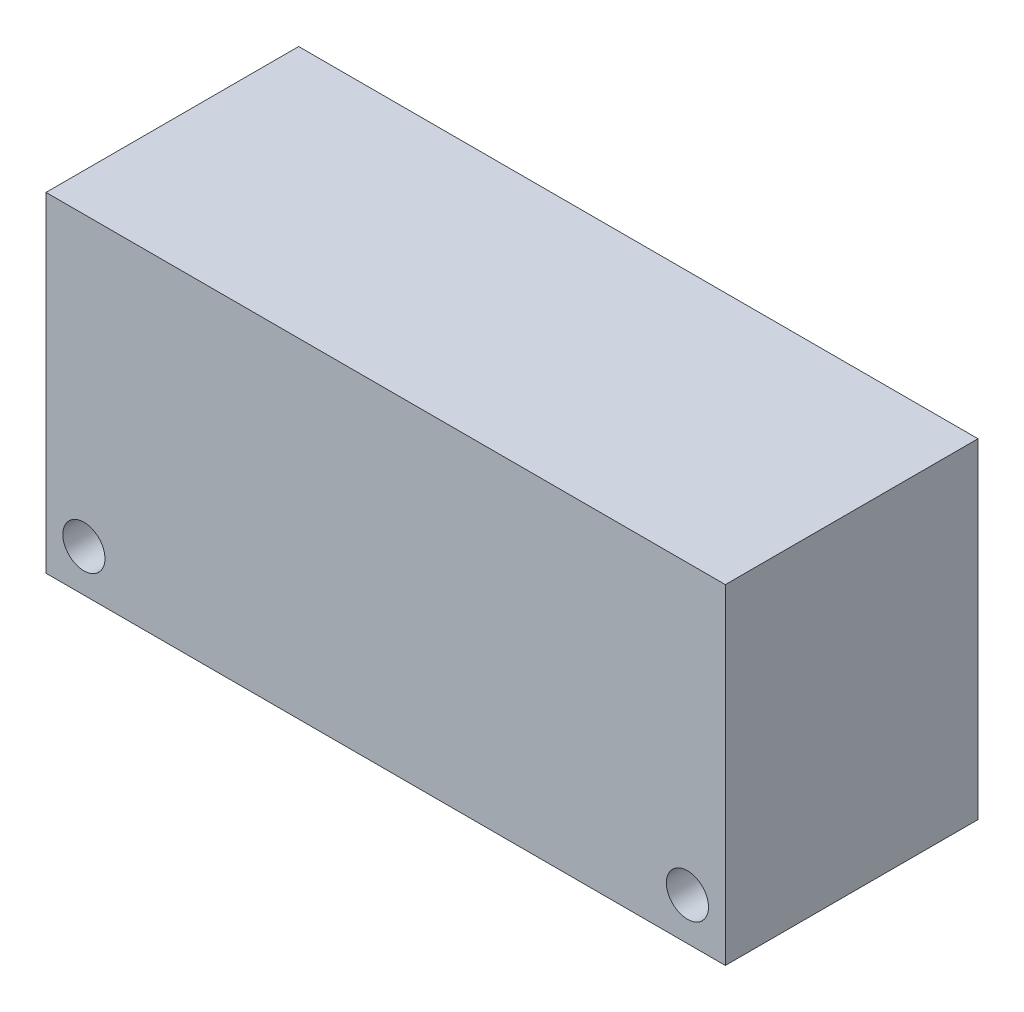
from build123d import *

# Parameters (mm, degrees)
SKETCH_1_W      = 48.4
SKETCH_1_H      = 23.5
SKETCH_1_R      = 1.5
EXTRUDE_1_DEPTH = 18


with BuildPart() as part:
    # 草圖1 → 伸長1 (new body)
    with BuildSketch(Plane.XY):
        Rectangle(SKETCH_1_W, SKETCH_1_H)
        with Locations((-21.5, -8.75)):
            Circle(SKETCH_1_R, mode=Mode.SUBTRACT)
        with Locations((21.5, -8.75)):
            Circle(SKETCH_1_R, mode=Mode.SUBTRACT)
    extrude(amount=EXTRUDE_1_DEPTH)


solid = part.part
